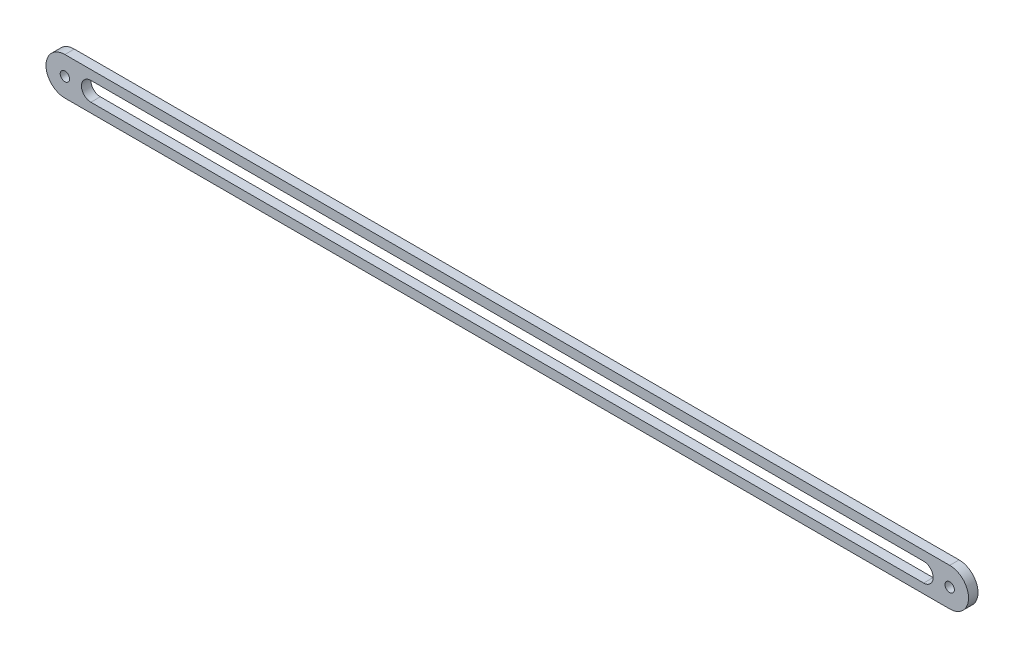
from build123d import *

# Parameters (mm, degrees)
SKETCH1_R           = 1.5875
BOSS_EXTRUDE2_DEPTH = 1.6


with BuildPart() as part:
    # Sketch1 → Boss-Extrude2 (new, symmetric)
    with BuildSketch(Plane.XY):
        with BuildLine():
            Line((-149.999999691, 6.4), (149.999999691, 6.4))
            ThreePointArc((149.999999691, 6.4), (156.399999534, -1.57e-07), (149.999999377, -6.4))
            Line((149.999999377, -6.4), (-149.999999377, -6.4))
            ThreePointArc((-149.999999377, -6.4), (-156.4, -1.57e-07), (-149.999999691, 6.4))
        make_face()
        with Locations((-150, 0)):
            Circle(SKETCH1_R, mode=Mode.SUBTRACT)
        with Locations((149.999999534, 0)):
            Circle(SKETCH1_R, mode=Mode.SUBTRACT)
        with BuildLine():
            Line((141.185, 3.2), (-141.185, 3.2))
            ThreePointArc((-141.185, 3.2), (-144.385, 0), (-141.185, -3.2))
            Line((-141.185, -3.2), (141.185, -3.2))
            ThreePointArc((141.185, -3.2), (144.385, 0), (141.185, 3.2))
        make_face(mode=Mode.SUBTRACT)
    extrude(amount=BOSS_EXTRUDE2_DEPTH, both=True)


solid = part.part
